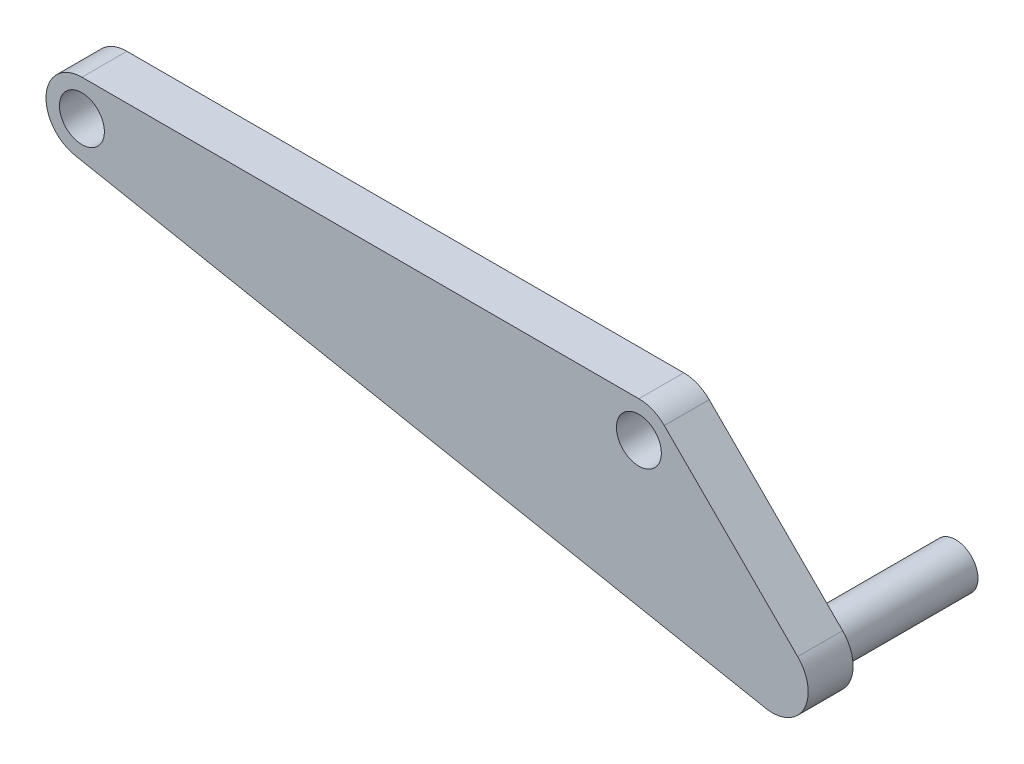
from build123d import *

# Parameters (mm, degrees)
SKETCH2_R           = 2.5
BOSS_EXTRUDE1_DEPTH = 5
SKETCH3_R           = 2.5
SKETCH3_R_2         = 0.5
BOSS_EXTRUDE2_DEPTH = 15.4


with BuildPart() as part:
    # Sketch2 → Boss-Extrude1 (new body)
    with BuildSketch(Plane.XY):
        with BuildLine():
            Line((-62, 4), (0, 4))
            ThreePointArc((0, 4), (1.530733729, 3.69551813), (2.828427125, 2.828427125))
            Line((2.828427125, 2.828427125), (17.67766953, -12.02081528))
            ThreePointArc((17.67766953, -12.02081528), (18.382077171, -16.725163117), (14.09037667, -18.776598105))
            Line((14.09037667, -18.776598105), (-62.758865735, -3.9273557))
            ThreePointArc((-62.758865735, -3.9273557), (-65.981797509, 0.381167417), (-62, 4))
        make_face()
        with Locations((-62, 0)):
            Circle(SKETCH2_R, mode=Mode.SUBTRACT)
        Circle(SKETCH2_R, mode=Mode.SUBTRACT)
    extrude(amount=BOSS_EXTRUDE1_DEPTH)

    # Sketch3 → Boss-Extrude2 (add)
    with BuildSketch(Plane(origin=(0, 0, 0), x_dir=(-1, 0, 0), z_dir=(0, 0, -1))):
        with Locations(Location((-14.849242405, -14.849242405, 0), (0, 0, 180))):
            Circle(SKETCH3_R)
        with Locations((-14.849242405, -14.849242405)):
            Circle(SKETCH3_R_2, mode=Mode.SUBTRACT)
    extrude(amount=BOSS_EXTRUDE2_DEPTH)


solid = part.part
